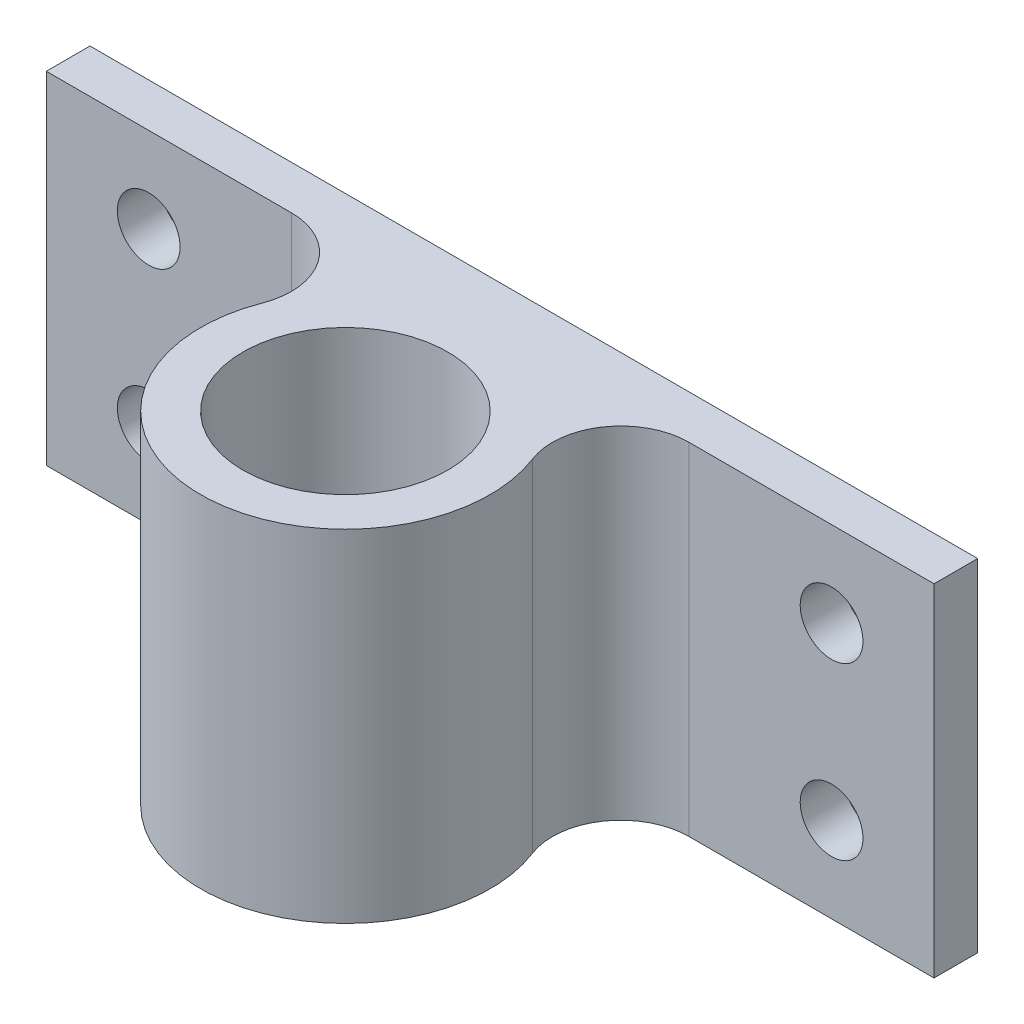
from build123d import *

# Parameters (mm, degrees)
SKETCH3_R           = 75
BOSS_EXTRUDE1_DEPTH = 250
SKETCH4_R           = 22.984114262
CUT_EXTRUDE1_DEPTH  = 478.138344718


with BuildPart() as part:
    # Sketch3 → Boss-Extrude1 (new body)
    with BuildSketch(Plane(origin=(0, 0, 0), x_dir=(1, 0, 0), z_dir=(0, 1, 0))):
        with BuildLine():
            Line((-325, 138), (-325, 106))
            Line((-325, 106), (-145.602197786, 106))
            ThreePointArc((-145.602197786, 106), (-104.386691617, 84.306925854), (-98.9348267, 38.051282051))
            ThreePointArc((-98.9348267, 38.051282051), (0, -106), (98.9348267, 38.051282051))
            ThreePointArc((98.9348267, 38.051282051), (104.386691617, 84.306925854), (145.602197786, 106))
            Line((145.602197786, 106), (325, 106))
            Line((325, 106), (325, 138))
            Line((325, 138), (-325, 138))
        make_face()
        with Locations(Location((0, 0, 0), (0, 0, 270))):
            Circle(SKETCH3_R, mode=Mode.SUBTRACT)
    extrude(amount=BOSS_EXTRUDE1_DEPTH)

    # Sketch4 → Cut-Extrude1 (cut, through all)
    with BuildSketch(Plane(origin=(0, 0, -138), x_dir=(-1, 0, 0), z_dir=(0, 0, -1))):
        with Locations((-250, 187.5)):
            Circle(SKETCH4_R)
        with Locations((250, 187.5)):
            Circle(SKETCH4_R)
        with Locations((250, 62.5)):
            Circle(SKETCH4_R)
        with Locations((-250, 62.5)):
            Circle(SKETCH4_R)
    extrude(amount=-CUT_EXTRUDE1_DEPTH, mode=Mode.SUBTRACT)


solid = part.part
